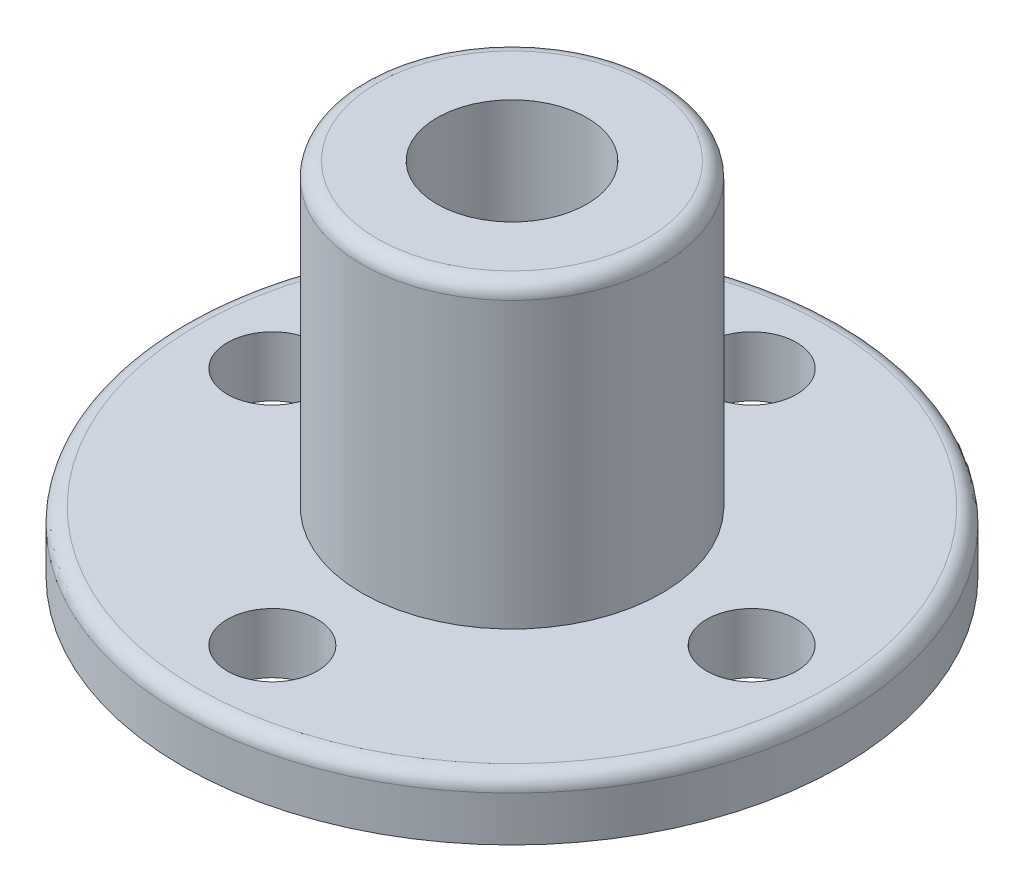
from build123d import *

# Parameters (mm, degrees)
SKETCH_1_R          = 11
EXTRUDE_1_DEPTH     = 2
SKETCH_2_R          = 5
EXTRUDE_2_DEPTH     = 10
SKETCH_3_R          = 2.5
CUT_EXTRUDE_1_DEPTH = 10
HOLE_WIZARD_1_D     = 3
FILLET_1_R          = 0.5


with BuildPart() as part:
    # 草图1 → 凸台-拉伸1 (new body)
    with BuildSketch(Plane(origin=(0, 0, 0), x_dir=(1, 0, 0), z_dir=(0, 1, 0))):
        with Locations(Location((0, 0, 0), (0, 0, 270))):
            Circle(SKETCH_1_R)
    extrude(amount=EXTRUDE_1_DEPTH)

    # 草图2 → 凸台-拉伸2 (add)
    with BuildSketch(Plane(origin=(0, 2, 0), x_dir=(1, 0, 0), z_dir=(0, 1, 0))):
        with Locations(Location((0, 0, 0), (0, 0, 270))):
            Circle(SKETCH_2_R)
    extrude(amount=EXTRUDE_2_DEPTH)

    # 草图3 → 切除-拉伸1 (cut)
    with BuildSketch(Plane(origin=(0, 12, 0), x_dir=(1, 0, 0), z_dir=(0, 1, 0))):
        with Locations(Location((0, 0, 0), (0, 0, 270))):
            Circle(SKETCH_3_R)
    extrude(amount=-CUT_EXTRUDE_1_DEPTH, mode=Mode.SUBTRACT)

    # 孔1 (through all)
    with Locations(Plane(origin=(0, 2, 0), x_dir=(1, 0, 0), z_dir=(0, 1, 0))):
        with Locations((0, 8), (8, 0), (0, -8), (-8, 0)):
            Hole(HOLE_WIZARD_1_D / 2)

    # 圆角1
    fillet_1_edges = [part.edges().sort_by_distance(p)[0] for p in [
        (0, 2, -11),
        (0, 12, -5),
    ]]
    fillet(fillet_1_edges, radius=FILLET_1_R)


solid = part.part
